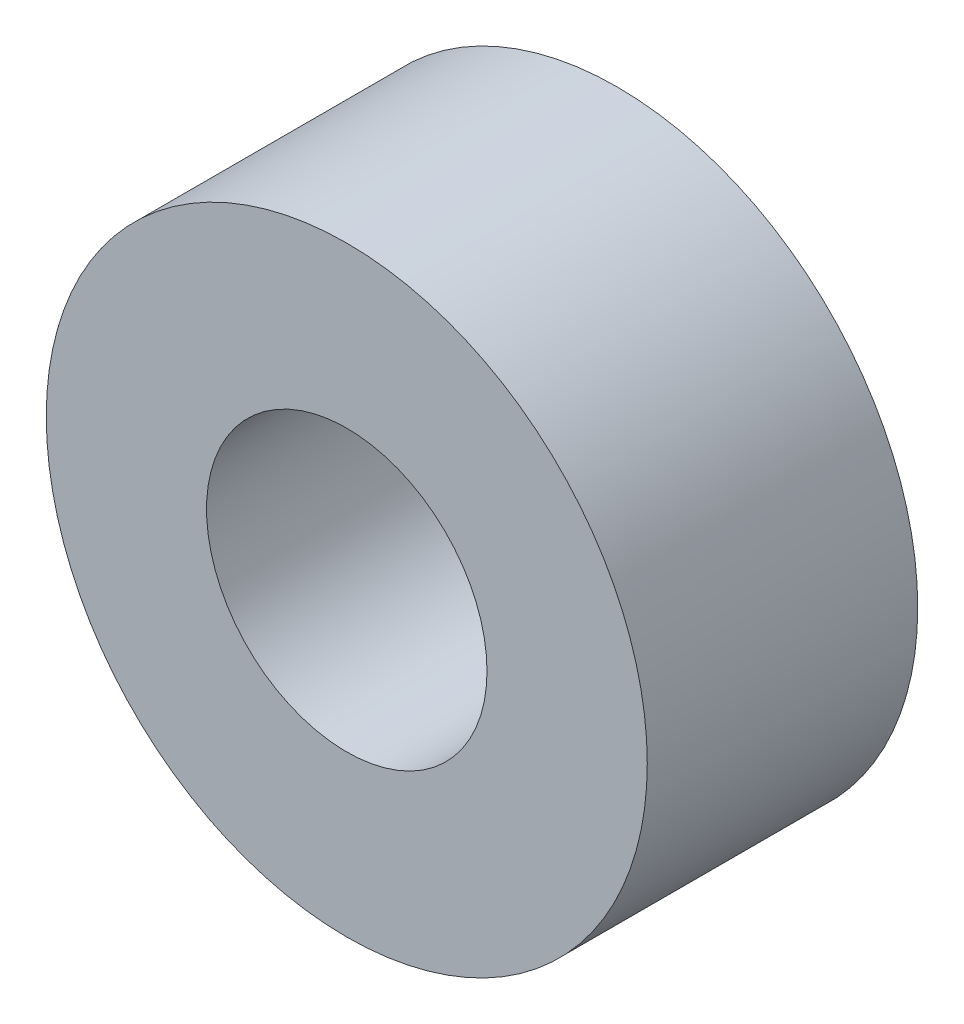
from build123d import *

# Parameters (mm, degrees)
EXTRUDE_1_DEPTH      = 2
EXTRUDE_1_DEPTH_BACK = 52
SKETCH_1_R           = 60
SKETCH_1_R_2         = 28


with BuildPart() as part:
    # 草图1 → 凸台-拉伸1 (new, two sides: drawn at the far end of the back side and taken through both)
    with BuildSketch(Plane.XY.offset(-EXTRUDE_1_DEPTH_BACK)):
        Circle(SKETCH_1_R)
        Circle(SKETCH_1_R_2, mode=Mode.SUBTRACT)
    extrude(amount=EXTRUDE_1_DEPTH + EXTRUDE_1_DEPTH_BACK)


solid = part.part
